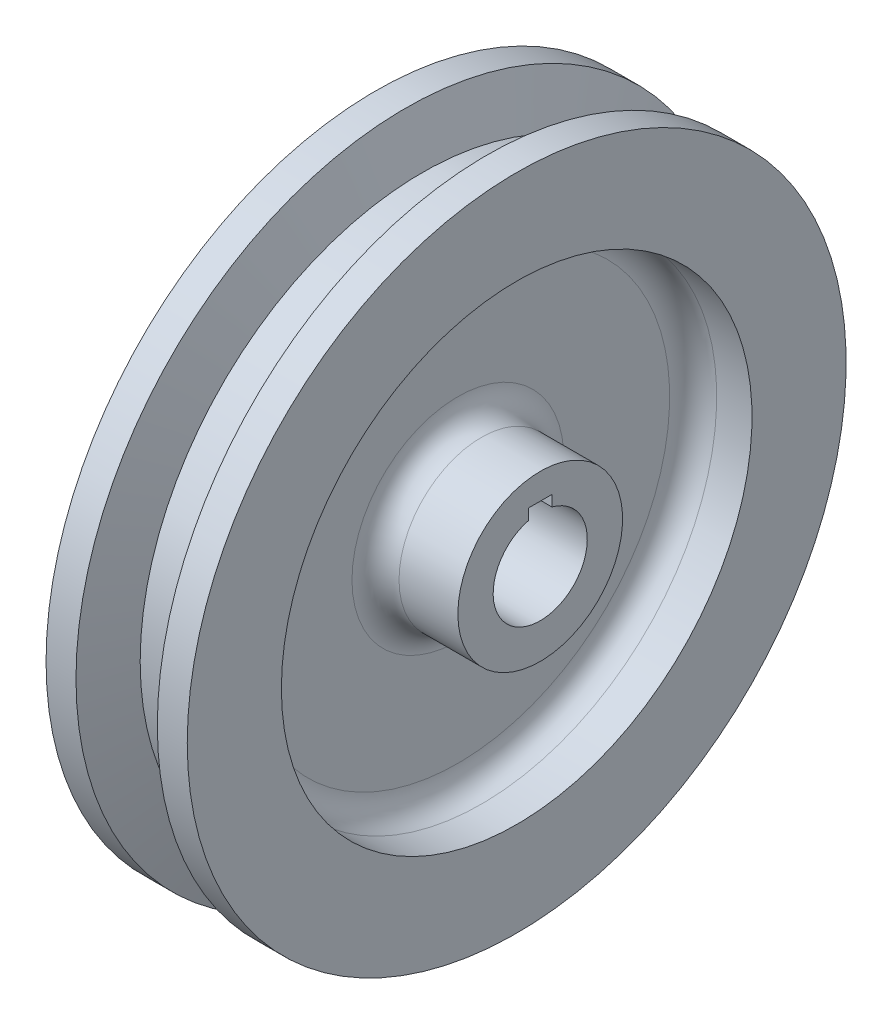
from build123d import *

# Parameters (mm, degrees)
FILLET1_R          = 6.35
CUT_EXTRUDE1_DEPTH = 136.598893801


with BuildPart() as part:
    # Sketch1 → Revolve1 (revolve)
    with BuildSketch(Plane.XY, mode=Mode.PRIVATE) as revolve1_sk:
        Polygon((-25.4, 0), (25.4, 0), (25.4, 22.225), (3.175, 22.225), (3.175, 63.5), (19.05, 63.5), (19.05, 88.9), (10.972421975, 88.9), (6.35, 76.2), (-6.35, 76.2), (-10.972421975, 88.9), (-19.05, 88.9), (-19.05, 63.5), (-3.175, 63.5), (-3.175, 22.225), (-25.4, 22.225), align=None)
    revolve(revolve1_sk.sketch.rotate(Axis((-25.4, 0, 0), (1, 0, 0)), 90), axis=Axis((-25.4, 0, 0), (1, 0, 0)))

    # Fillet1
    fillet1_edges = [part.edges().sort_by_distance(p)[0] for p in [
        (3.175, 0, -22.225),
        (3.175, 0, -63.5),
        (-3.175, 0, -63.5),
        (-3.175, 0, -22.225),
    ]]
    fillet(fillet1_edges, radius=FILLET1_R)

    # Sketch3 → Cut-Extrude1 (cut, through all)
    with BuildSketch(Plane.ZY.offset(25.4)):
        with BuildLine():
            Line((-3.175, 15.24), (3.175, 15.24))
            Line((3.175, 15.24), (3.175, 12.296722124))
            ThreePointArc((3.175, 12.296722124), (0, -12.7), (-3.175, 12.296722124))
            Line((-3.175, 12.296722124), (-3.175, 15.24))
        make_face()
    extrude(amount=-CUT_EXTRUDE1_DEPTH, mode=Mode.SUBTRACT)


solid = part.part
